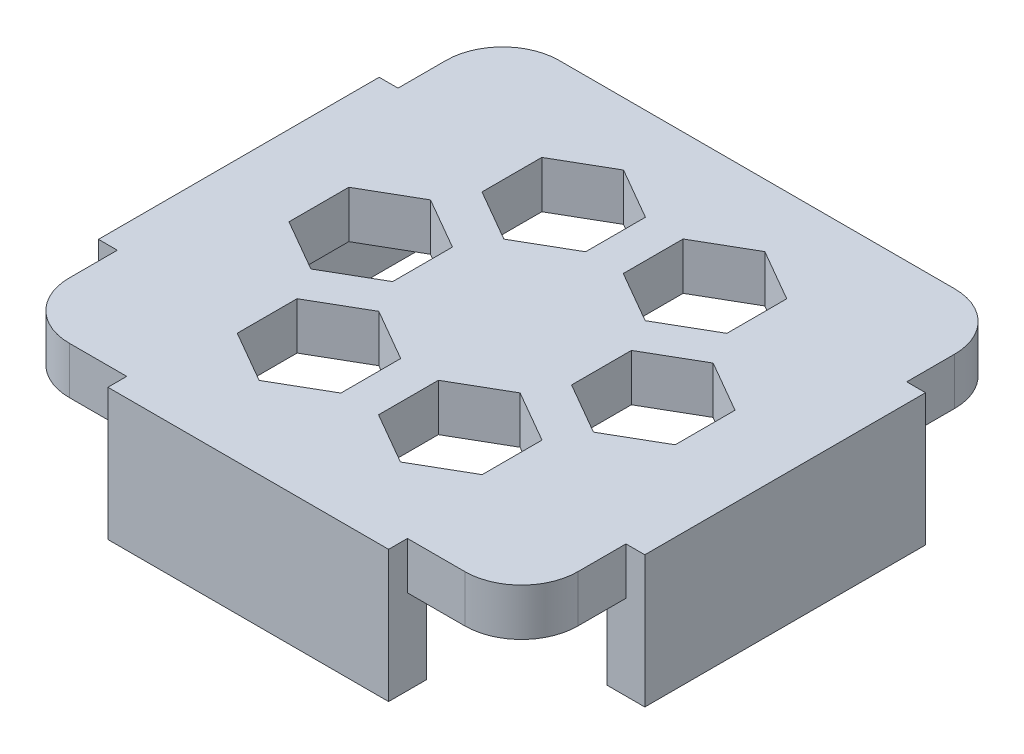
from build123d import *

# Parameters (mm, degrees)
BOSS_EXTRUDE1_DEPTH      = 2.5
BOSS_EXTRUDE2_DEPTH      = 4.5
BOSS_EXTRUDE2_DEPTH_BACK = 2.5
SKETCH2_W                = 2
SKETCH2_H                = 14.9
SKETCH2_W_2              = 14.9
SKETCH2_H_2              = 2
CUT_EXTRUDE1_DEPTH       = 10


with BuildPart() as part:
    # Sketch1 → Boss-Extrude1 (new body)
    with BuildSketch(Plane(origin=(0, 0, 0), x_dir=(1, 0, 0), z_dir=(0, 1, 0))):
        with BuildLine():
            Line((-10.5, -13), (10.5, -13))
            ThreePointArc((10.5, -13), (12.621320344, -12.121320344), (13.5, -10))
            Line((13.5, -10), (13.5, 10))
            ThreePointArc((13.5, 10), (12.621320344, 12.121320344), (10.5, 13))
            Line((10.5, 13), (-10.5, 13))
            ThreePointArc((-10.5, 13), (-12.621320344, 12.121320344), (-13.5, 10))
            Line((-13.5, 10), (-13.5, -10))
            ThreePointArc((-13.5, -10), (-12.621320344, -12.121320344), (-10.5, -13))
        make_face()
    extrude(amount=BOSS_EXTRUDE1_DEPTH)

    # Sketch2 → Boss-Extrude2 (add, two sides: drawn at the far end of the back side and taken through both)
    with BuildSketch(Plane.XZ.offset(-BOSS_EXTRUDE2_DEPTH_BACK)):
        with Locations((-13.5, 0)):
            Rectangle(SKETCH2_W, SKETCH2_H)
        with Locations((13.5, 0)):
            Rectangle(SKETCH2_W, SKETCH2_H)
        with Locations((0, 13)):
            Rectangle(SKETCH2_W_2, SKETCH2_H_2)
    extrude(amount=BOSS_EXTRUDE2_DEPTH + BOSS_EXTRUDE2_DEPTH_BACK)

    # Sketch3 → Cut-Extrude1 (cut)
    with BuildSketch(Plane(origin=(0, 2.5, 0), x_dir=(1, 0, 0), z_dir=(0, 1, 0))):
        Polygon((1, -4.907477288), (3.75, -3.319764048), (6.5, -4.907477288), (6.5, -8.082903769), (3.75, -9.670617009), (1, -8.082903769), align=None)
        Polygon((-3.75, 3.319764048), (-1, 4.907477288), (-1, 8.082903769), (-3.75, 9.670617009), (-6.5, 8.082903769), (-6.5, 4.907477288), align=None)
        Polygon((-7.5, -3.175426481), (-4.75, -1.58771324), (-4.75, 1.58771324), (-7.5, 3.175426481), (-10.25, 1.58771324), (-10.25, -1.58771324), align=None)
        Polygon((7.5, -3.175426481), (10.25, -1.58771324), (10.25, 1.58771324), (7.5, 3.175426481), (4.75, 1.58771324), (4.75, -1.58771324), align=None)
        Polygon((3.75, 3.319764048), (6.5, 4.907477288), (6.5, 8.082903769), (3.75, 9.670617009), (1, 8.082903769), (1, 4.907477288), align=None)
        Polygon((-6.5, -4.907477288), (-3.75, -3.319764048), (-1, -4.907477288), (-1, -8.082903769), (-3.75, -9.670617009), (-6.5, -8.082903769), align=None)
    extrude(amount=-CUT_EXTRUDE1_DEPTH, mode=Mode.SUBTRACT)


solid = part.part
